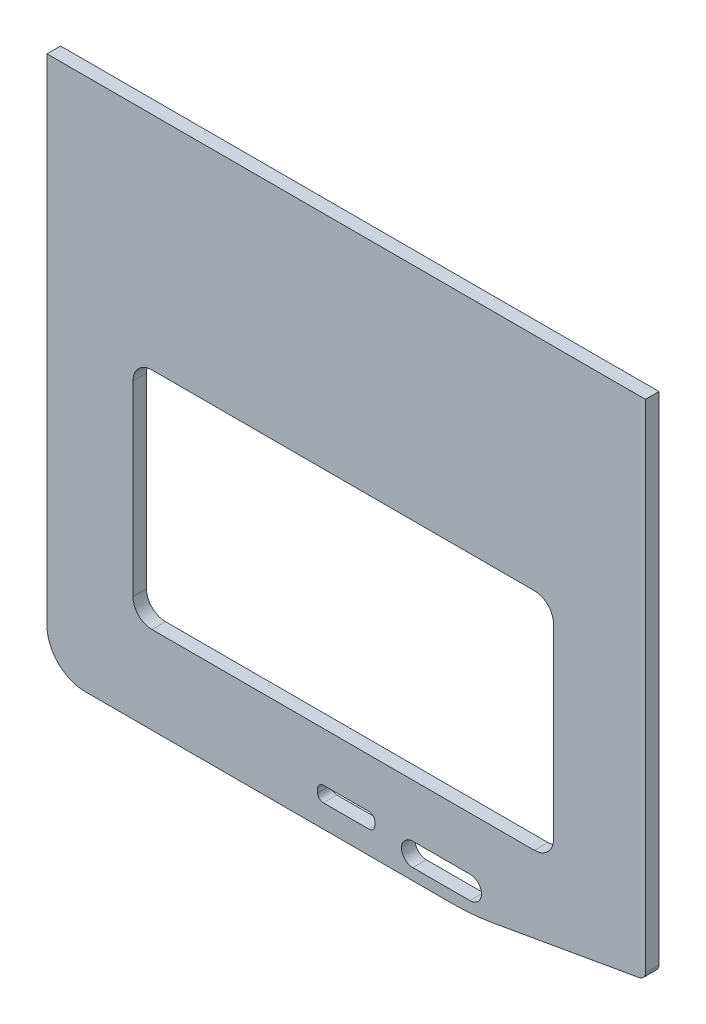
from build123d import *

# Parameters (mm, degrees)
SKETCH1_W               = 314.224
SKETCH1_H               = 280
BOSS_EXTRUDE1_DEPTH     = 7.112
CUT_EXTRUDE1_DEPTH      = 304.866353991
CUT_EXTRUDE1_DEPTH_BACK = 304.866353991
CUT_EXTRUDE2_DEPTH      = 304.866353991
CUT_EXTRUDE3_DEPTH      = 304.866353991
FILLET1_R               = 120
FILLET2_R               = 20
FILLET3_R               = 4
CUT_EXTRUDE4_DEPTH      = 304.866353991


with BuildPart() as part:
    # Sketch1 → Boss-Extrude1 (new body)
    with BuildSketch(Plane(origin=(0, 0, 0), x_dir=(1, 0, 0), z_dir=(0, 0, -1))):
        with Locations((0, -120)):
            Rectangle(SKETCH1_W, SKETCH1_H)
    extrude(amount=BOSS_EXTRUDE1_DEPTH)

    # Sketch2 → Cut-Extrude1 (cut, two sides: drawn at the far end of the back side and taken through both)
    with BuildSketch(Plane.XY.offset(-CUT_EXTRUDE1_DEPTH_BACK)):
        with BuildLine():
            Line((-101.985505074, 143.817457954), (98.803851758, 143.817457954))
            ThreePointArc((98.803851758, 143.817457954), (105.87491957, 140.888525766), (108.803851758, 133.817457954))
            Line((108.803851758, 133.817457954), (108.803851758, 35.797968831))
            ThreePointArc((108.803851758, 35.797968831), (105.87491957, 28.726901019), (98.803851758, 25.797968831))
            Line((98.803851758, 25.797968831), (-101.985505074, 25.797968831))
            ThreePointArc((-101.985505074, 25.797968831), (-109.056572886, 28.726901019), (-111.985505074, 35.797968831))
            Line((-111.985505074, 35.797968831), (-111.985505074, 133.817457954))
            ThreePointArc((-111.985505074, 133.817457954), (-109.056572886, 140.888525766), (-101.985505074, 143.817457954))
        make_face()
    extrude(amount=CUT_EXTRUDE1_DEPTH + CUT_EXTRUDE1_DEPTH_BACK, mode=Mode.SUBTRACT)

    # Sketch3 → Cut-Extrude2 (cut, through all)
    with BuildSketch(Plane.XY):
        with BuildLine():
            Line((-12, -8), (12, -8))
            ThreePointArc((12, -8), (14.121320344, -7.121320344), (15, -5))
            Line((15, -5), (15, -3))
            ThreePointArc((15, -3), (14.121320344, -0.878679656), (12, 0))
            Line((12, 0), (-12, 0))
            ThreePointArc((-12, 0), (-14.121320344, -0.878679656), (-15, -3))
            Line((-15, -3), (-15, -5))
            ThreePointArc((-15, -5), (-14.121320344, -7.121320344), (-12, -8))
        make_face()
    extrude(amount=-CUT_EXTRUDE2_DEPTH, mode=Mode.SUBTRACT)

    # Sketch4 → Cut-Extrude3 (cut, through all)
    with BuildSketch(Plane.XY):
        Polygon((66.371490886, -20), (157.112, -4), (157.112, -20), align=None)
    extrude(amount=-CUT_EXTRUDE3_DEPTH, mode=Mode.SUBTRACT)

    # Fillet1
    fillet1_edges = [part.edges().sort_by_distance(p)[0] for p in [
        (66.371490886, -20, -3.556),
    ]]
    fillet(fillet1_edges, radius=FILLET1_R)

    # Fillet2
    fillet2_edges = [part.edges().sort_by_distance(p)[0] for p in [
        (-157.112, -20, -3.556),
    ]]
    fillet(fillet2_edges, radius=FILLET2_R)

    # Fillet3
    fillet3_edges = [part.edges().sort_by_distance(p)[0] for p in [
        (157.112, -4, -3.556),
    ]]
    fillet(fillet3_edges, radius=FILLET3_R)

    # Sketch5 → Cut-Extrude4 (cut, through all)
    with BuildSketch(Plane.XY):
        with BuildLine():
            Line((35, -2), (65, -2))
            ThreePointArc((65, -2), (71, -8), (65, -14))
            Line((65, -14), (35, -14))
            ThreePointArc((35, -14), (29, -8), (35, -2))
        make_face()
    extrude(amount=-CUT_EXTRUDE4_DEPTH, mode=Mode.SUBTRACT)


solid = part.part
